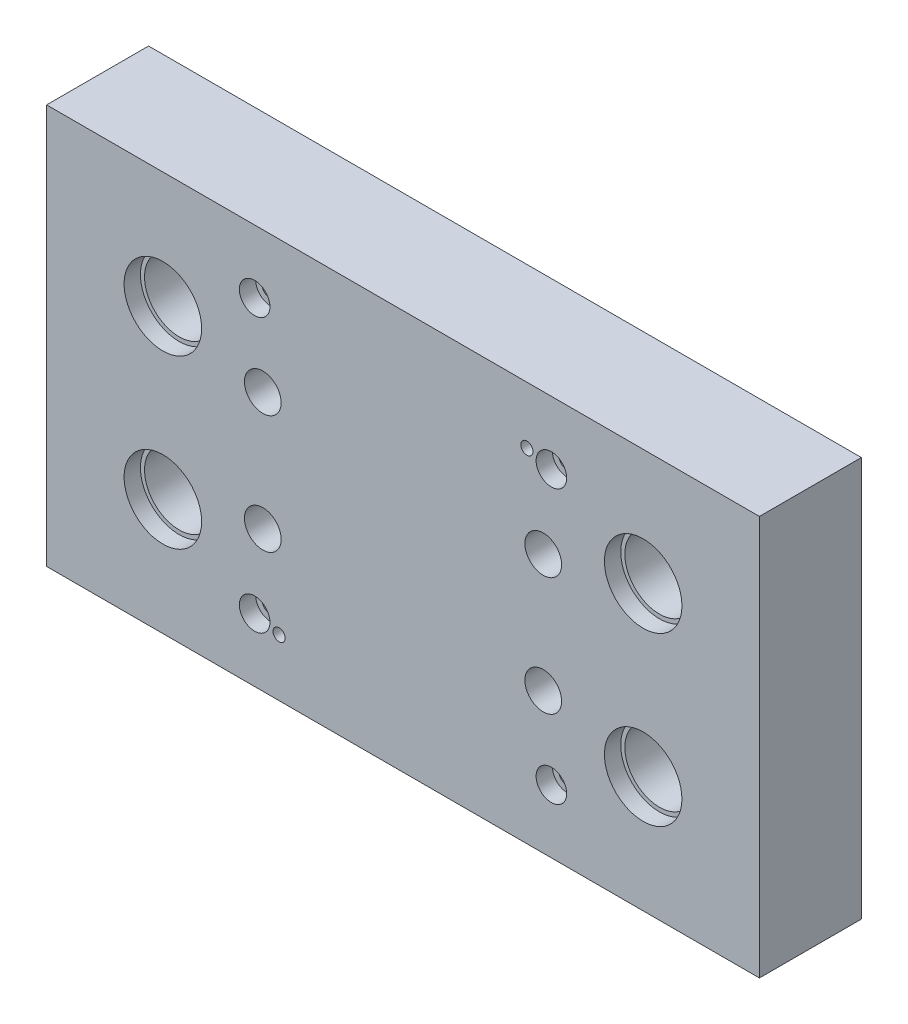
from build123d import *

# Parameters (mm, degrees)
SKETCH1_W                       = 349.5
SKETCH1_H                       = 196
BOSS_EXTRUDE1_DEPTH             = 50
CBORE_FOR_M8_SHCS1_D            = 9
CBORE_FOR_M8_SHCS1_CBORE_D      = 15
CBORE_FOR_M8_SHCS1_CBORE_DEPTH  = 8
F_6_0MM_CLEARANCE_DOWEL_HOLE1_D = 6
CBORE_FOR_M10_SHSS1_D           = 11
CBORE_FOR_M10_SHSS1_CBORE_D     = 18
CBORE_FOR_M10_SHSS1_CBORE_DEPTH = 14.5
HOLE1_D                         = 34
HOLE1_CBORE_D                   = 38
HOLE1_CBORE_DEPTH               = 8


with BuildPart() as part:
    # Sketch1 → Boss-Extrude1 (new body)
    with BuildSketch(Plane.XY):
        with Locations((34.75, 0)):
            Rectangle(SKETCH1_W, SKETCH1_H)
    extrude(amount=BOSS_EXTRUDE1_DEPTH)

    # CBORE for M8 SHCS1 (through all)
    with Locations(Plane(origin=(0, 0, 50), x_dir=(0.9063077870366375, -0.42261826174072625, 0), z_dir=(0, 0, 1))):
        with Locations((125.743510643, -15.291158594), (69.11266357, 106.154084869), (-62.755119444, 44.663127785), (-6.124272371, -76.782115678)):
            CounterBoreHole(CBORE_FOR_M8_SHCS1_D / 2, CBORE_FOR_M8_SHCS1_CBORE_D / 2, CBORE_FOR_M8_SHCS1_CBORE_DEPTH)

    # Ø6.0mm Clearance Dowel Hole1 (through all)
    with Locations(Plane(origin=(0, 0, 50), x_dir=(0.9063077870366375, -0.42261826174072625, 0), z_dir=(0, 0, 1))):
        with Locations((56.96911534, 103.801589089), (6.019275859, -74.429619898)):
            Hole(F_6_0MM_CLEARANCE_DOWEL_HOLE1_D / 2)

    # CBORE for M10 SHSS1 (through all)
    with Locations(Plane(origin=(0, 0, 50), x_dir=(0.9063077870366375, -0.42261826174072625, 0), z_dir=(0, 0, 1))):
        with Locations((-43.07039435, 11.913904925), (-18.558535169, -40.651946723), (81.546926368, 70.023915914), (106.058785549, 17.458064266)):
            CounterBoreHole(CBORE_FOR_M10_SHSS1_D / 2, CBORE_FOR_M10_SHSS1_CBORE_D / 2, CBORE_FOR_M10_SHSS1_CBORE_DEPTH)

    # Hole1 (through all)
    with Locations(Plane(origin=(-83, 41, 50), x_dir=(1, 0, 0), z_dir=(0, 0, 1))):
        with Locations((0, 0), (0, -82), (235.5, 0), (235.5, -82)):
            CounterBoreHole(HOLE1_D / 2, HOLE1_CBORE_D / 2, HOLE1_CBORE_DEPTH)


solid = part.part
